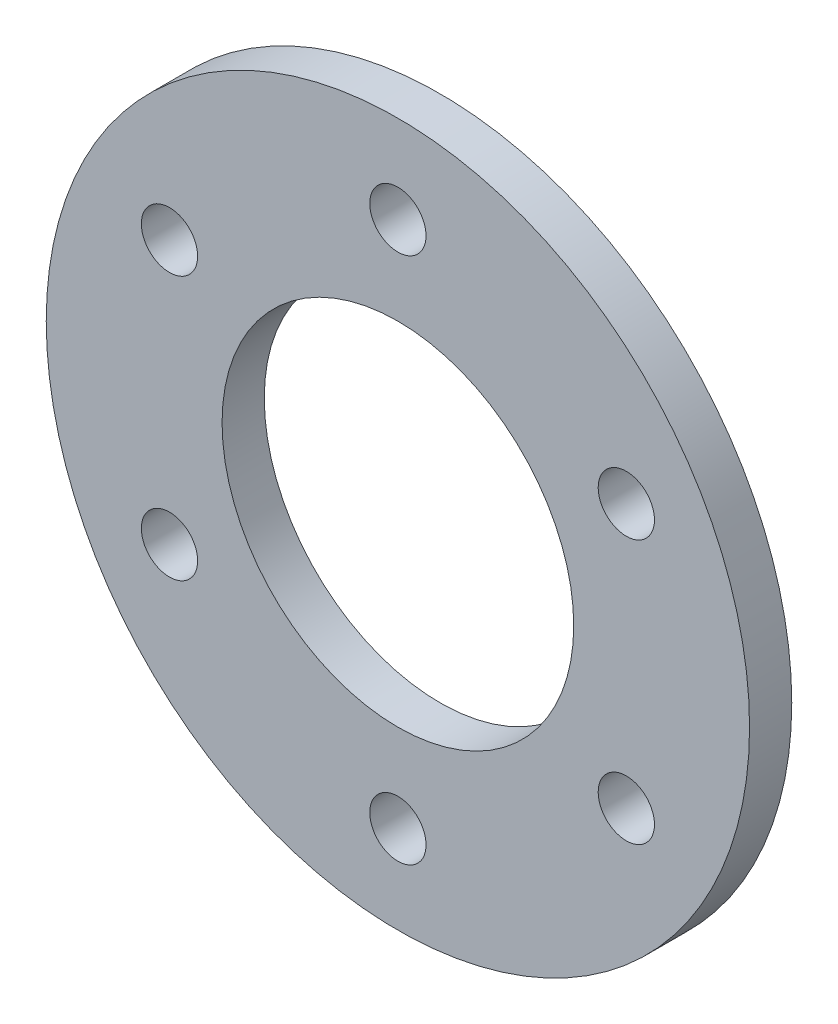
from build123d import *

# Parameters (mm, degrees)
SKETCH1_R           = 25
BOSS_EXTRUDE1_DEPTH = 3
SKETCH4_R           = 12.5
CUT_EXTRUDE1_DEPTH  = 8.2
SKETCH11_R          = 2
CUT_EXTRUDE2_DEPTH  = 10


with BuildPart() as part:
    # Sketch1 → Boss-Extrude1 (new body)
    with BuildSketch(Plane.XY):
        Circle(SKETCH1_R)
    extrude(amount=BOSS_EXTRUDE1_DEPTH)

    # Sketch4 → Cut-Extrude1 (cut)
    with BuildSketch(Plane(origin=(0, 0, 0), x_dir=(-1, 0, 0), z_dir=(0, 0, -1))):
        Circle(SKETCH4_R)
    extrude(amount=-CUT_EXTRUDE1_DEPTH, mode=Mode.SUBTRACT)

    # Sketch11 → Cut-Extrude2 (cut)
    with BuildSketch(Plane(origin=(0, 0, 0), x_dir=(-1, 0, 0), z_dir=(0, 0, -1))):
        with Locations((0, 18.75)):
            Circle(SKETCH11_R)
        with Locations((16.237976321, 9.375)):
            Circle(SKETCH11_R)
        with Locations((16.237976321, -9.375)):
            Circle(SKETCH11_R)
        with Locations((0, -18.75)):
            Circle(SKETCH11_R)
        with Locations((-16.237976321, -9.375)):
            Circle(SKETCH11_R)
        with Locations((-16.237976321, 9.375)):
            Circle(SKETCH11_R)
    extrude(amount=-CUT_EXTRUDE2_DEPTH, mode=Mode.SUBTRACT)


solid = part.part
